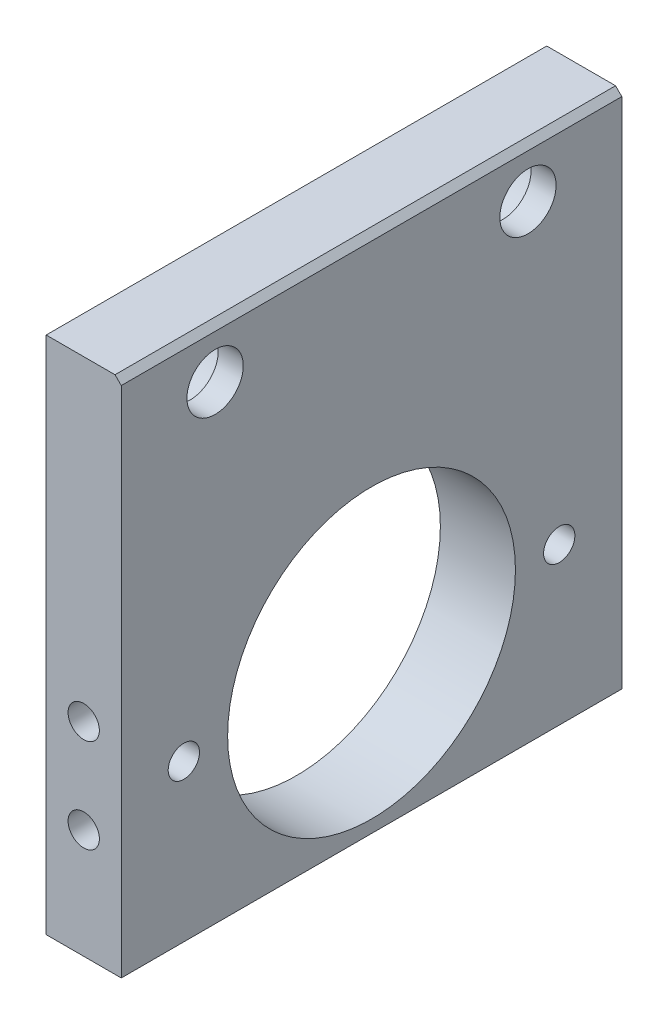
from build123d import *

# Parameters (mm, degrees)
SKETCH_1_W                  = 80
SKETCH_1_H                  = 83
EXTRUDE_1_DEPTH             = 12
HOLE_WIZARD_1_D             = 9
HOLE_WIZARD_1_CBORE_D       = 15
HOLE_WIZARD_1_CBORE_DEPTH   = 8
HOLE_WIZARD_1_2_D           = 46
HOLE_WIZARD_M6_2_D          = 5
HOLE_WIZARD_M6_1_AT_2_COUNT = 2
HOLE_WIZARD_M6_1_AT_2_PITCH = 15
CHAMFER_1_SIZE              = 1


with BuildPart() as part:
    # 草图1 → 凸台-拉伸1 (new body)
    with BuildSketch(Plane(origin=(0, 0, 0), x_dir=(0, 0, -1), z_dir=(1, 0, 0))):
        Rectangle(SKETCH_1_W, SKETCH_1_H)
    extrude(amount=EXTRUDE_1_DEPTH)

    # Hole Wizard 1 (through all)
    with Locations(Plane.ZY):
        with Locations((-25, 33.5), (25, 33.5)):
            CounterBoreHole(HOLE_WIZARD_1_D / 2, HOLE_WIZARD_1_CBORE_D / 2, HOLE_WIZARD_1_CBORE_DEPTH)

    # Hole Wizard 1 2 (through all)
    with Locations(Plane(origin=(12, 0, 0), x_dir=(0, 0, -1), z_dir=(1, 0, 0))):
        with Locations((0, -16.5)):
            Hole(HOLE_WIZARD_1_2_D / 2)

    # M6 螺纹孔2 (through all)
    with Locations(Plane.ZY):
        with Locations((-30, -16.5), (30, -16.5)):
            Hole(HOLE_WIZARD_M6_2_D / 2)

    # 草图8 → M6 螺纹孔1 (revolve, cut)
    with BuildSketch(Plane(origin=(6, -9, -40), x_dir=(0, 1, 0), z_dir=(1, 0, 0))):
        Polygon((0, 0), (0, 16.502151548), (2.5, 15), (2.5, 0), align=None)
    hole_wizard_m6_1 = revolve(axis=Axis((6, -9, -46.35), (0, 0, 1)), mode=Mode.SUBTRACT)

    # M6 螺纹孔1 at 2: M6 螺纹孔1 ×2
    with Locations(*[(0, -i * HOLE_WIZARD_M6_1_AT_2_PITCH, 0) for i in range(1, HOLE_WIZARD_M6_1_AT_2_COUNT)]):
        add(hole_wizard_m6_1, mode=Mode.SUBTRACT)

    # 镜向1: M6 螺纹孔1 across plane
    add(hole_wizard_m6_1.mirror(Plane.XY), mode=Mode.SUBTRACT)

    # 镜向1 copy 1 sketch → 镜向1 copy 1 (revolve, cut)
    with BuildSketch(Plane(origin=(6, -24, 40), x_dir=(0, 1, 0), z_dir=(1, 0, 0))):
        Polygon((0, 0), (0, -16.502151548), (2.5, -15), (2.5, 0), align=None)
    revolve(axis=Axis((6, -24, 46.35), (0, 0, 1)), mode=Mode.SUBTRACT)

    # 倒角1
    chamfer_1_edges = [part.edges().sort_by_distance(p)[0] for p in [
        (12, 41.5, 0),
    ]]
    chamfer(chamfer_1_edges, length=CHAMFER_1_SIZE)


solid = part.part
